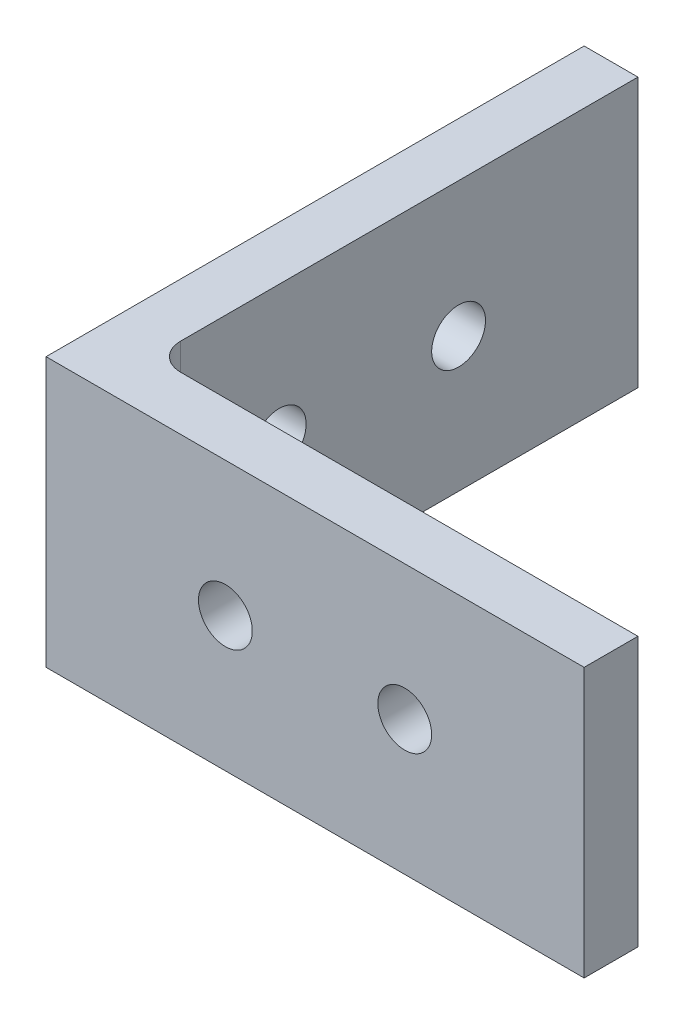
from build123d import *

# Parameters (mm, degrees)
BOSS_EXTRUDE1_DEPTH = 25
FILLET1_R           = 5
SKETCH2_R           = 5
CUT_EXTRUDE1_DEPTH  = 137.839321834
SKETCH3_R           = 5
CUT_EXTRUDE2_DEPTH  = 137.839321834


with BuildPart() as part:
    # Sketch1 → Boss-Extrude1 (new, symmetric)
    with BuildSketch(Plane(origin=(0, 0, 0), x_dir=(1, 0, 0), z_dir=(0, 1, 0))):
        Polygon((0, 0), (0, 100), (10, 100), (10, 10), (100, 10), (100, 0), align=None)
    extrude(amount=BOSS_EXTRUDE1_DEPTH, both=True)

    # Fillet1
    fillet1_edges = [part.edges().sort_by_distance(p)[0] for p in [
        (10, 0, -10),
    ]]
    fillet(fillet1_edges, radius=FILLET1_R)

    # Sketch2 → Cut-Extrude1 (cut, through all)
    with BuildSketch(Plane(origin=(10, 0, 0), x_dir=(0, 0, -1), z_dir=(1, 0, 0))):
        with Locations((33.333, 0)):
            Circle(SKETCH2_R)
        with Locations((66.666, 0)):
            Circle(SKETCH2_R)
    extrude(amount=-CUT_EXTRUDE1_DEPTH, mode=Mode.SUBTRACT)

    # Sketch3 → Cut-Extrude2 (cut, through all)
    with BuildSketch(Plane(origin=(0, 0, -10), x_dir=(-1, 0, 0), z_dir=(0, 0, -1))):
        with Locations((-33.33, 0)):
            Circle(SKETCH3_R)
        with Locations((-66.66, 0)):
            Circle(SKETCH3_R)
    extrude(amount=-CUT_EXTRUDE2_DEPTH, mode=Mode.SUBTRACT)


solid = part.part
